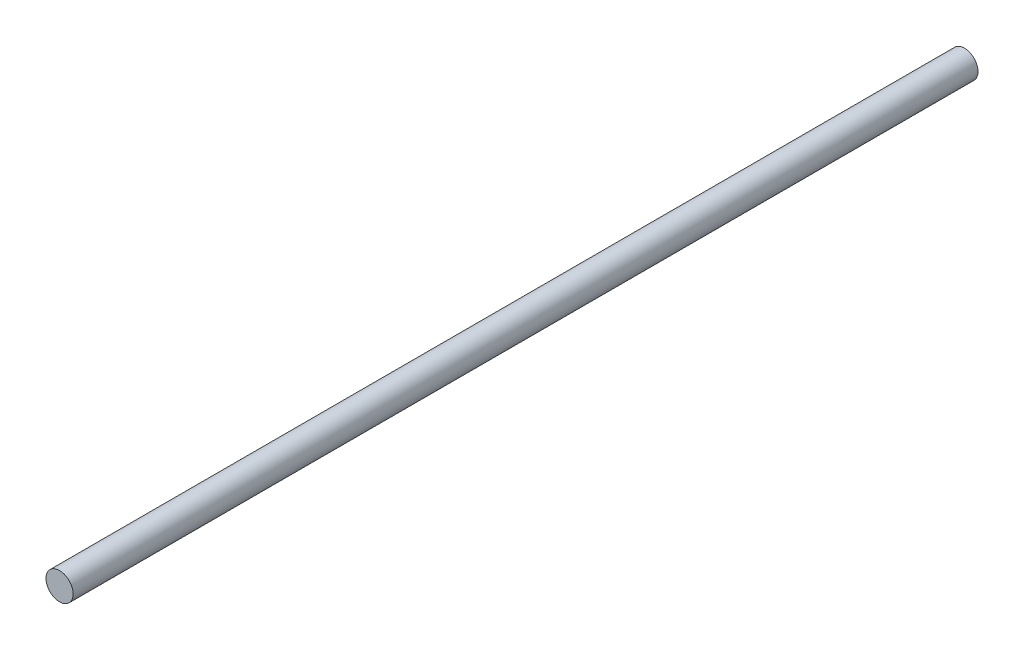
from build123d import *

# Parameters (mm, degrees)
IZIM1_R                     = 6
Y_KSEKLIK_EKSTR_ZYON1_DEPTH = 400


with BuildPart() as part:
    # Çizim1 → Yükseklik-Ekstrüzyon1 (new body)
    with BuildSketch(Plane.XY):
        Circle(IZIM1_R)
    extrude(amount=Y_KSEKLIK_EKSTR_ZYON1_DEPTH)


solid = part.part
